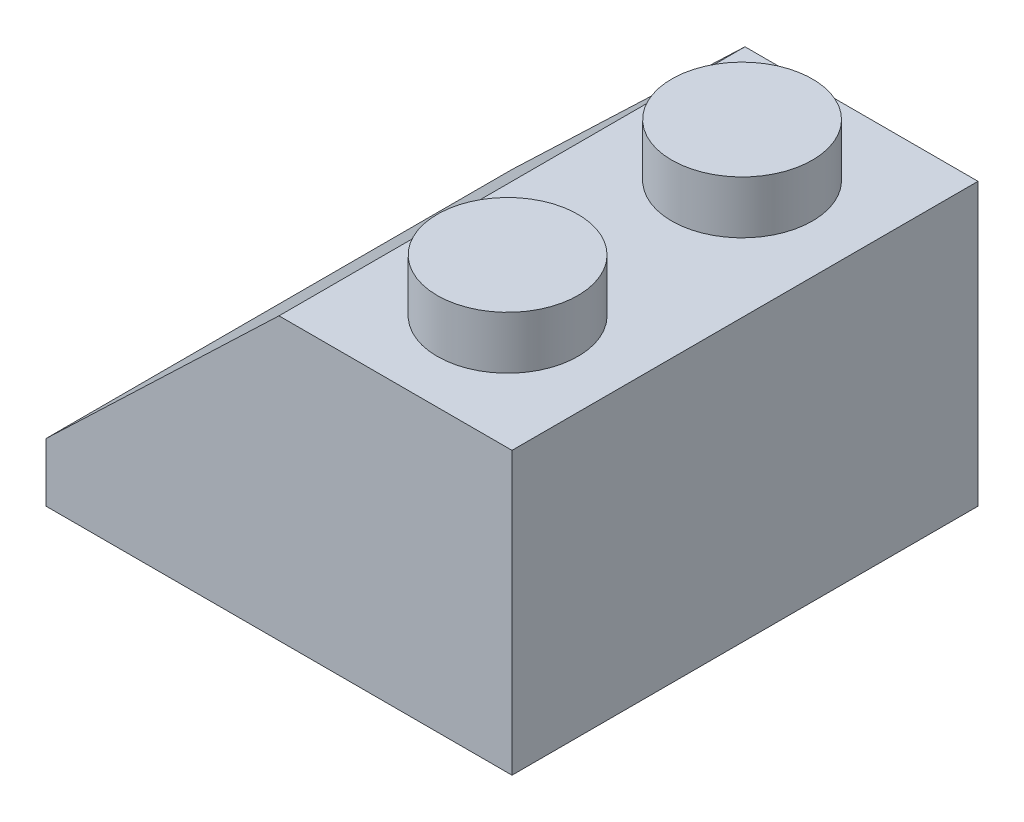
from build123d import *

# Parameters (mm, degrees)
BOSS_EXTRUDE1_DEPTH = 7.95
SKETCH2_R           = 2.4
BOSS_EXTRUDE2_DEPTH = 1.8
LPATTERN1_COUNT     = 2
LPATTERN1_PITCH     = 8
SHELL1_T            = -0.5
SKETCH3_R           = 3
SKETCH3_R_2         = 2.4
BOSS_EXTRUDE3_DEPTH = 9.1
SKETCH4_W           = 10.998295323
SKETCH4_H           = 15.9
CUT_EXTRUDE1_DEPTH  = 15.757300106


with BuildPart() as part:
    # Sketch1 → Boss-Extrude1 (new, symmetric)
    with BuildSketch(Plane.XY):
        Polygon((0, 0), (-15.9, 0), (-15.9, 2), (-7.95, 9.6), (0, 9.6), align=None)
    extrude(amount=BOSS_EXTRUDE1_DEPTH, both=True)

    # Sketch2 → Boss-Extrude2 (add)
    with BuildSketch(Plane(origin=(0, 9.6, 0), x_dir=(1, 0, 0), z_dir=(0, 1, 0))):
        with Locations(Location((-4.05, -4.05, 0), (0, 0, 270))):
            Circle(SKETCH2_R)
    boss_extrude2 = extrude(amount=BOSS_EXTRUDE2_DEPTH)

    # LPattern1: Boss-Extrude2 ×2
    with Locations(*[(0, 0, -i * LPATTERN1_PITCH) for i in range(1, LPATTERN1_COUNT)]):
        add(boss_extrude2)

    # Shell1
    shell1_openings = [part.faces().sort_by_distance(p)[0] for p in [
        (-7.95, 0, 0),
    ]]
    offset(amount=SHELL1_T, openings=shell1_openings, kind=Kind.INTERSECTION)

    # Sketch3 → Boss-Extrude3 (add)
    with BuildSketch(Plane.XZ.offset(-9.1)):
        with Locations(Location((-8.05, 0.05, 0), (0, 0, 84.250353958))):
            Circle(SKETCH3_R)
        with Locations(Location((-8.05, 0.05, 0), (0, 0, 82.806112334))):
            Circle(SKETCH3_R_2, mode=Mode.SUBTRACT)
    extrude(amount=BOSS_EXTRUDE3_DEPTH)

    # Sketch4 → Cut-Extrude1 (cut, through all)
    with BuildSketch(Plane(origin=(-8.591290689, 8.986942234, 0), x_dir=(0.7228392916279055, 0.6910161781600108, 0), z_dir=(-0.6910161781600108, 0.7228392916279055, 0))):
        with Locations((-4.611964719, 0)):
            Rectangle(SKETCH4_W, SKETCH4_H)
    extrude(amount=CUT_EXTRUDE1_DEPTH, mode=Mode.SUBTRACT)


solid = part.part
